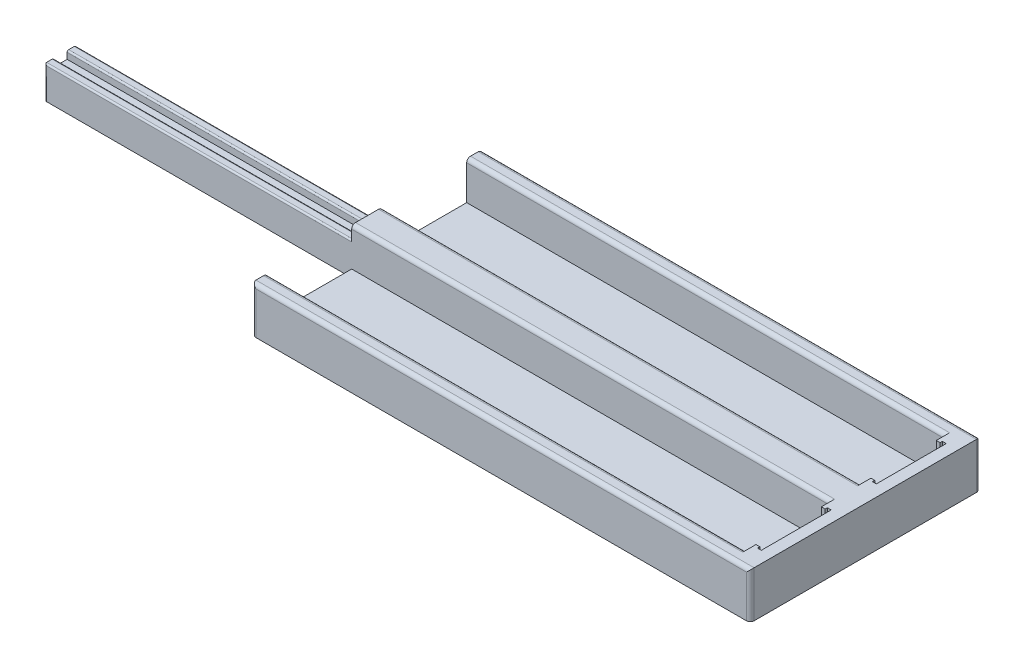
from build123d import *

# Parameters (mm, degrees)
SKETCH1_W           = 130
SKETCH1_H           = 60
BOSS_EXTRUDE1_DEPTH = 12
CUT_EXTRUDE1_START  = -5
SKETCH2_W           = 22
SKETCH2_H           = 10
CUT_EXTRUDE1_DEPTH  = 129.955216397
CUT_EXTRUDE2_START  = -2
SKETCH3_W           = 0.6
SKETCH3_H           = 8.4
SKETCH3_H_2         = 0.6
SKETCH3_W_2         = 17.05
CUT_EXTRUDE2_DEPTH  = 1
CUT_EXTRUDE3_START  = -2
SKETCH3_3_W         = 17.05
SKETCH3_3_H         = 8.4
CUT_EXTRUDE3_DEPTH  = 2
BOSS_EXTRUDE2_DEPTH = 80
FILLET1_R           = 0.4
FILLET2_R           = 1


with BuildPart() as part:
    # Sketch1 → Boss-Extrude1 (new body)
    with BuildSketch(Plane(origin=(0, 0, 0), x_dir=(1, 0, 0), z_dir=(0, 1, 0))):
        Rectangle(SKETCH1_W, SKETCH1_H)
    extrude(amount=BOSS_EXTRUDE1_DEPTH)

    # Sketch2 → Cut-Extrude1 (cut, through all)
    with BuildSketch(Plane(origin=(65, 0, 0), x_dir=(0, 0, -1), z_dir=(1, 0, 0)).offset(CUT_EXTRUDE1_START)):
        with Locations((15, 7)):
            Rectangle(SKETCH2_W, SKETCH2_H)
    cut_extrude1 = extrude(amount=-CUT_EXTRUDE1_DEPTH, mode=Mode.SUBTRACT)

    # Mirror1: Cut-Extrude1 across plane
    add(cut_extrude1.mirror(Plane.XY), mode=Mode.SUBTRACT)

    # Sketch3 → Cut-Extrude2 (cut)
    with BuildSketch(Plane.ZY.offset(-60).offset(CUT_EXTRUDE2_START)):
        with Locations((23.825, 7.8)):
            Rectangle(SKETCH3_W, SKETCH3_H)
        with Locations((23.825, 3.3)):
            Rectangle(SKETCH3_W, SKETCH3_H_2)
        with Locations((15, 7.8)):
            Rectangle(SKETCH3_W_2, SKETCH3_H)
        with Locations((15, 3.3)):
            Rectangle(SKETCH3_W_2, SKETCH3_H_2)
        with Locations((6.175, 3.3)):
            Rectangle(SKETCH3_W, SKETCH3_H_2)
        with Locations((6.175, 7.8)):
            Rectangle(SKETCH3_W, SKETCH3_H)
    cut_extrude2 = extrude(amount=CUT_EXTRUDE2_DEPTH, mode=Mode.SUBTRACT)

    # Sketch3<3> → Cut-Extrude3 (cut)
    with BuildSketch(Plane.ZY.offset(-60).offset(CUT_EXTRUDE3_START)):
        with Locations((15, 7.8)):
            Rectangle(SKETCH3_3_W, SKETCH3_3_H)
    cut_extrude3 = extrude(amount=CUT_EXTRUDE3_DEPTH, mode=Mode.SUBTRACT)

    # Mirror2: Cut-Extrude2, Cut-Extrude3 across plane
    add(cut_extrude2.mirror(Plane.XY), mode=Mode.SUBTRACT)
    add(cut_extrude3.mirror(Plane.XY), mode=Mode.SUBTRACT)

    # Sketch4 → Boss-Extrude2 (add)
    with BuildSketch(Plane.ZY.offset(65)):
        Polygon((4, 2), (4, 8.5), (1.75, 8.5), (1.75, 6.5), (-1.75, 6.5), (-1.75, 8.5), (-4, 8.5), (-4, 2), (-4, 0), (4, 0), align=None)
    extrude(amount=BOSS_EXTRUDE2_DEPTH)

    # Fillet1
    fillet1_edges = [part.edges().sort_by_distance(p)[0] for p in [
        (-105, 8.5, -1.75),
        (-105, 8.5, -4),
        (-145, 4.25, 4),
        (-105, 8.5, 4),
        (-105, 8.5, 1.75),
        (-145, 4.25, -4),
    ]]
    fillet(fillet1_edges, radius=FILLET1_R)

    # Fillet2
    fillet2_edges = [part.edges().sort_by_distance(p)[0] for p in [
        (0, 12, 30),
        (-2.5, 12, -4),
        (-2.5, 12, -26),
        (-2.5, 12, 26),
        (-2.5, 12, 4),
        (65, 6, 30),
        (-65, 6, 30),
        (-65, 6, -30),
        (65, 6, -30),
        (0, 12, -30),
    ]]
    fillet(fillet2_edges, radius=FILLET2_R)


solid = part.part
